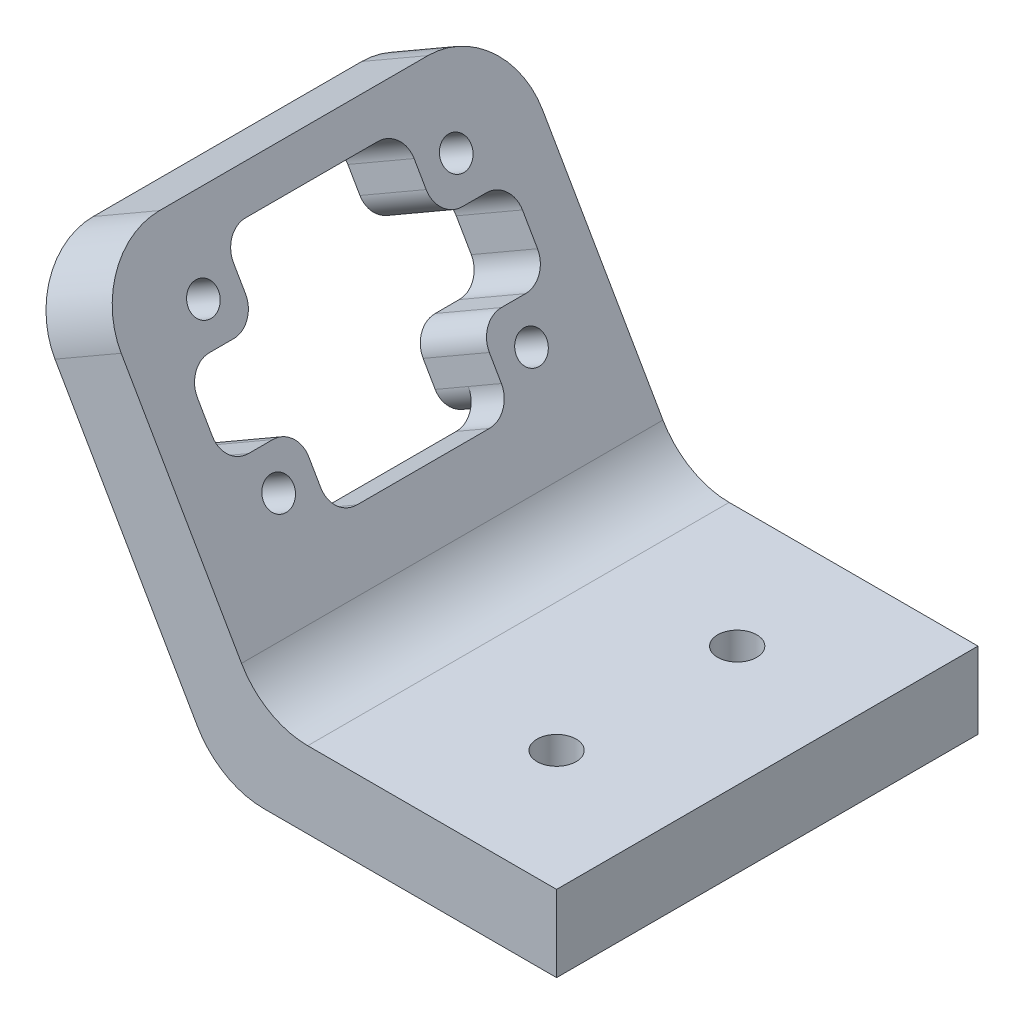
from build123d import *

# Parameters (mm, degrees)
SKETCH1_W           = 28
SKETCH1_H           = 35
SKETCH1_R           = 1.625
BOSS_EXTRUDE1_DEPTH = 6.35
BOSS_EXTRUDE2_DEPTH = 35
SKETCH3_W           = 6
SKETCH3_H           = 6.5
SKETCH3_W_2         = 15
SKETCH3_H_2         = 6
SKETCH3_R           = 1.25
CUT_EXTRUDE1_DEPTH  = 6.35
SKETCH4_W           = 27
SKETCH4_H           = 26.166174209
CUT_EXTRUDE2_DEPTH  = 3.175
FILLET1_R           = 2
FILLET2_R           = 6.35
FILLET3_R           = 2


with BuildPart() as part:
    # Sketch1 → Boss-Extrude1 (new body)
    with BuildSketch(Plane(origin=(0, 0, 0), x_dir=(1, 0, 0), z_dir=(0, 1, 0))):
        Rectangle(SKETCH1_W, SKETCH1_H)
        with Locations(Location((4, 7.5, 0), (0, 0, 270))):
            Circle(SKETCH1_R, mode=Mode.SUBTRACT)
        with Locations(Location((4, -7.5, 0), (0, 0, 270))):
            Circle(SKETCH1_R, mode=Mode.SUBTRACT)
    extrude(amount=BOSS_EXTRUDE1_DEPTH)

    # Sketch2 → Boss-Extrude2 (add)
    with BuildSketch(Plane.XY.offset(17.5)):
        Polygon((-14, 0), (-30.833087105, 29.155762114), (-25.333825791, 32.330762114), (-10.333825791, 6.35), align=None)
    extrude(amount=-BOSS_EXTRUDE2_DEPTH)

    # Sketch3 → Cut-Extrude1 (cut)
    with BuildSketch(Plane(origin=(-10.5, -6.062177826, 0), x_dir=(0, 0, 1), z_dir=(-0.8660254037844415, -0.4999999999999949, 0))):
        with Locations((-10.5, 28.416174209)):
            Rectangle(SKETCH3_W, SKETCH3_H)
        with Locations((0, 28.416174209)):
            Rectangle(SKETCH3_W_2, SKETCH3_H)
        with Locations((0, 34.666174209)):
            Rectangle(SKETCH3_W_2, SKETCH3_H_2)
        with Locations(Location((-10.5, 34.666174209, 0), (0, 0, 270))):
            Circle(SKETCH3_R)
        with Locations(Location((-10.5, 22.166174209, 0), (0, 0, 270))):
            Circle(SKETCH3_R)
        with Locations(Location((10.5, 22.166174209, 0), (0, 0, 270))):
            Circle(SKETCH3_R)
        with Locations(Location((10.5, 34.666174209, 0), (0, 0, 270))):
            Circle(SKETCH3_R)
        with Locations((10.5, 28.416174209)):
            Rectangle(SKETCH3_W, SKETCH3_H)
        with Locations((0, 22.166174209)):
            Rectangle(SKETCH3_W_2, SKETCH3_H_2)
    extrude(amount=-CUT_EXTRUDE1_DEPTH, mode=Mode.SUBTRACT)

    # Sketch4 → Cut-Extrude2 (cut)
    with BuildSketch(Plane(origin=(-10.5, -6.062177826, 0), x_dir=(0, 0, 1), z_dir=(-0.8660254037844417, -0.49999999999999484, 0))):
        with Locations((0, 6.083087105)):
            Rectangle(SKETCH4_W, SKETCH4_H)
    extrude(amount=-CUT_EXTRUDE2_DEPTH, mode=Mode.SUBTRACT)

    # Fillet1
    fillet1_edges = [part.edges().sort_by_distance(p)[0] for p in [
        (-18.708271776, 11.329965932, 7.5),
        (-18.708271776, 11.329965932, 13.5),
        (-18.708271776, 11.329965932, -13.5),
        (-20.333456448, 17.319868355, -7.5),
        (-20.333456448, 17.319868355, -13.5),
        (-23.583456448, 22.949033479, -13.5),
        (-23.583456448, 22.949033479, -7.5),
        (-26.583456448, 28.145185902, -7.5),
        (-26.583456448, 28.145185902, 7.5),
        (-23.583456448, 22.949033479, 7.5),
        (-23.583456448, 22.949033479, 13.5),
        (-20.333456448, 17.319868355, 13.5),
        (-20.333456448, 17.319868355, 7.5),
        (-18.708271776, 11.329965932, -7.5),
    ]]
    fillet(fillet1_edges, radius=FILLET1_R)

    # Fillet2
    fillet2_edges = [part.edges().sort_by_distance(p)[0] for p in [
        (-14, 0, 15.5),
        (-14, 0, -15.5),
        (-10.333825791, 6.35, 0),
        (-28.083456448, 30.743262114, 17.5),
        (-28.083456448, 30.743262114, -17.5),
        (-10.333825791, 0, 0),
    ]]
    fillet(fillet2_edges, radius=FILLET2_R)

    # Fillet3
    fillet3_edges = [part.edges().sort_by_distance(p)[0] for p in [
        (-15.958641119, 12.917465932, 7.5),
        (-15.958641119, 12.917465932, -7.5),
    ]]
    fillet(fillet3_edges, radius=FILLET3_R)


solid = part.part
